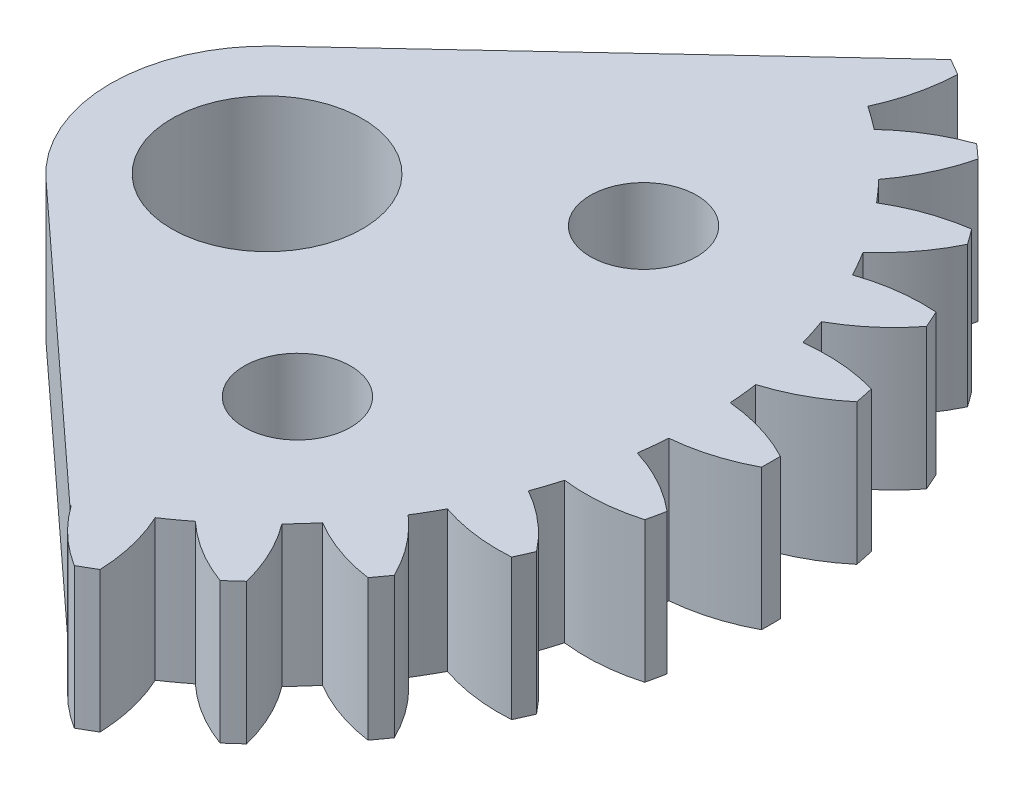
from build123d import *

# Parameters (mm, degrees)
SKETCH_1_R          = 2.6
SKETCH_1_R_2        = 6.1
EXTRUDE_1_DEPTH     = 9
CUT_EXTRUDE_START   = -10
SKETCH_2_R          = 3.4
SKETCH_2_R_2        = 2.6
CUT_EXTRUDE_1_DEPTH = 10


with BuildPart() as part:
    # 草图1 → 凸台-拉伸1 (new body)
    with BuildSketch(Plane(origin=(0, 0, 0), x_dir=(1, 0, 0), z_dir=(0, 1, 0))):
        with BuildLine():
            ThreePointArc((10.005741881, 19.864209328), (9.487119891, 20.17017771), (8.962832505, 20.466333337))
            Line((8.962832505, 20.466333337), (-13.385709221, -0.397651364))
            ThreePointArc((-13.385709221, -0.397651364), (-16.561513437, -7.747050572), (-13.327428101, -15.070990303))
            Line((-13.327428101, -15.070990303), (5.481515962, -32.352919827))
            ThreePointArc((5.481515962, -32.352919827), (5.510229247, -32.338868299), (5.538926138, -32.32478332))
            ThreePointArc((5.538926138, -32.32478332), (7.091187682, -34.107638735), (8.962832505, -35.551603759))
            ThreePointArc((8.962832505, -35.551603759), (9.487119891, -35.255448132), (10.005741881, -34.94947975))
            ThreePointArc((10.005741881, -34.94947975), (9.684229712, -32.57790044), (8.898482853, -30.317289822))
            ThreePointArc((8.898482853, -30.317289822), (9.650626544, -29.789793539), (10.384730504, -29.237467697))
            ThreePointArc((10.384730504, -29.237467697), (12.29188983, -30.683324466), (14.448043063, -31.721959019))
            ThreePointArc((14.448043063, -31.721959019), (14.899299295, -31.323269626), (15.342973746, -30.916159812))
            ThreePointArc((15.342973746, -30.916159812), (14.535408326, -28.663251339), (13.296824545, -26.615406445))
            ThreePointArc((13.296824545, -26.615406445), (13.922859447, -25.943057755), (14.526086474, -25.250172762))
            ThreePointArc((14.526086474, -25.250172762), (16.692180319, -26.267913372), (19.017160696, -26.835561803))
            ThreePointArc((19.017160696, -26.835561803), (19.375663711, -26.351763284), (19.724999921, -25.861304691))
            ThreePointArc((19.724999921, -25.861304691), (18.466675733, -23.825529966), (16.829387085, -22.079951444))
            ThreePointArc((16.829387085, -22.079951444), (17.30195247, -21.292135211), (17.747938649, -20.488973466))
            ThreePointArc((17.747938649, -20.488973466), (20.078298317, -21.034117768), (22.47049304, -21.105971118))
            ThreePointArc((22.47049304, -21.105971118), (22.720574536, -20.558207789), (22.960304836, -20.005835811))
            ThreePointArc((22.960304836, -20.005835811), (21.306216685, -18.276167958), (19.34178054, -16.909145965))
            ThreePointArc((19.34178054, -16.909145965), (19.640223033, -16.040293539), (19.909476627, -15.161957065))
            ThreePointArc((19.909476627, -15.161957065), (22.302254219, -15.210679637), (24.657112899, -14.783597569))
            ThreePointArc((24.657112899, -14.783597569), (24.787843115, -14.195809317), (24.907490141, -13.60566526))
            ThreePointArc((24.907490141, -13.60566526), (22.929929617, -12.257699063), (20.724201261, -11.328979021))
            ThreePointArc((20.724201261, -11.328979021), (20.835477492, -10.417063422), (20.916230828, -9.501939738))
            ThreePointArc((20.916230828, -9.501939738), (23.266850481, -9.052111169), (25.481454494, -8.14475922))
            ThreePointArc((25.481454494, -8.14475922), (25.487119891, -7.542635211), (25.481454494, -6.940511202))
            ThreePointArc((25.481454494, -6.940511202), (23.266850481, -6.033159253), (20.916230828, -5.583330684))
            ThreePointArc((20.916230828, -5.583330684), (20.835477492, -4.668206999), (20.724201261, -3.7562914))
            ThreePointArc((20.724201261, -3.7562914), (22.929929617, -2.827571359), (24.907490141, -1.479605162))
            ThreePointArc((24.907490141, -1.479605162), (24.787843115, -0.889461105), (24.657112899, -0.301672852))
            ThreePointArc((24.657112899, -0.301672852), (22.302254219, 0.125409215), (19.909476627, 0.076686643))
            ThreePointArc((19.909476627, 0.076686643), (19.640223033, 0.955023117), (19.34178054, 1.823875544))
            ThreePointArc((19.34178054, 1.823875544), (21.306216685, 3.190897536), (22.960304836, 4.92056539))
            ThreePointArc((22.960304836, 4.92056539), (22.720574536, 5.472937368), (22.47049304, 6.020700696))
            ThreePointArc((22.47049304, 6.020700696), (20.078298317, 5.948847346), (17.747938649, 5.403703045))
            ThreePointArc((17.747938649, 5.403703045), (17.30195247, 6.206864789), (16.829387085, 6.994681022))
            ThreePointArc((16.829387085, 6.994681022), (18.466675733, 8.740259544), (19.724999921, 10.77603427))
            ThreePointArc((19.724999921, 10.77603427), (19.375663711, 11.266492862), (19.017160696, 11.750291382))
            ThreePointArc((19.017160696, 11.750291382), (16.692180319, 11.18264295), (14.526086474, 10.16490234))
            ThreePointArc((14.526086474, 10.16490234), (13.922859447, 10.857787333), (13.296824545, 11.530136023))
            ThreePointArc((13.296824545, 11.530136023), (14.535408326, 13.577980918), (15.342973746, 15.830889391))
            ThreePointArc((15.342973746, 15.830889391), (14.899299295, 16.237999204), (14.448043063, 16.636688597))
            ThreePointArc((14.448043063, 16.636688597), (12.29188983, 15.598054044), (10.384730504, 14.152197275))
            ThreePointArc((10.384730504, 14.152197275), (9.650626544, 14.704523117), (8.898482853, 15.2320194))
            ThreePointArc((8.898482853, 15.2320194), (9.684229712, 17.492630019), (10.005741881, 19.864209328))
        make_face()
        with Locations(Location((6.745512081, -19.072672674, 0), (0, 0, 270))):
            Circle(SKETCH_1_R, mode=Mode.SUBTRACT)
        with Locations(Location((8.35961056, 1.436393055, 0), (0, 0, 270))):
            Circle(SKETCH_1_R, mode=Mode.SUBTRACT)
        with Locations(Location((-6.561592317, -7.707331828, 0), (0, 0, 270))):
            Circle(SKETCH_1_R_2, mode=Mode.SUBTRACT)
    extrude(amount=EXTRUDE_1_DEPTH)

    # 草图2 → 切除-拉伸1 (cut)
    # profile 1 of 2: a face of its own
    with BuildSketch(Plane(origin=(0, 9, 0), x_dir=(1, 0, 0), z_dir=(0, 1, 0)).offset(CUT_EXTRUDE_START)):
        with Locations(Location((8.35961056, 1.436393055, 0), (0, 0, 270))):
            Circle(SKETCH_2_R)
        with Locations((8.35961056, 1.436393055)):
            Circle(SKETCH_2_R_2, mode=Mode.SUBTRACT)
    # profile 2 of 2: a face of its own
    with BuildSketch(Plane(origin=(0, 9, 0), x_dir=(1, 0, 0), z_dir=(0, 1, 0)).offset(CUT_EXTRUDE_START)):
        with Locations(Location((6.745512081, -19.072672674, 0), (0, 0, 270))):
            Circle(SKETCH_2_R)
        with Locations((6.745512081, -19.072672674)):
            Circle(SKETCH_2_R_2, mode=Mode.SUBTRACT)
    extrude(amount=CUT_EXTRUDE_1_DEPTH, mode=Mode.SUBTRACT)


solid = part.part
